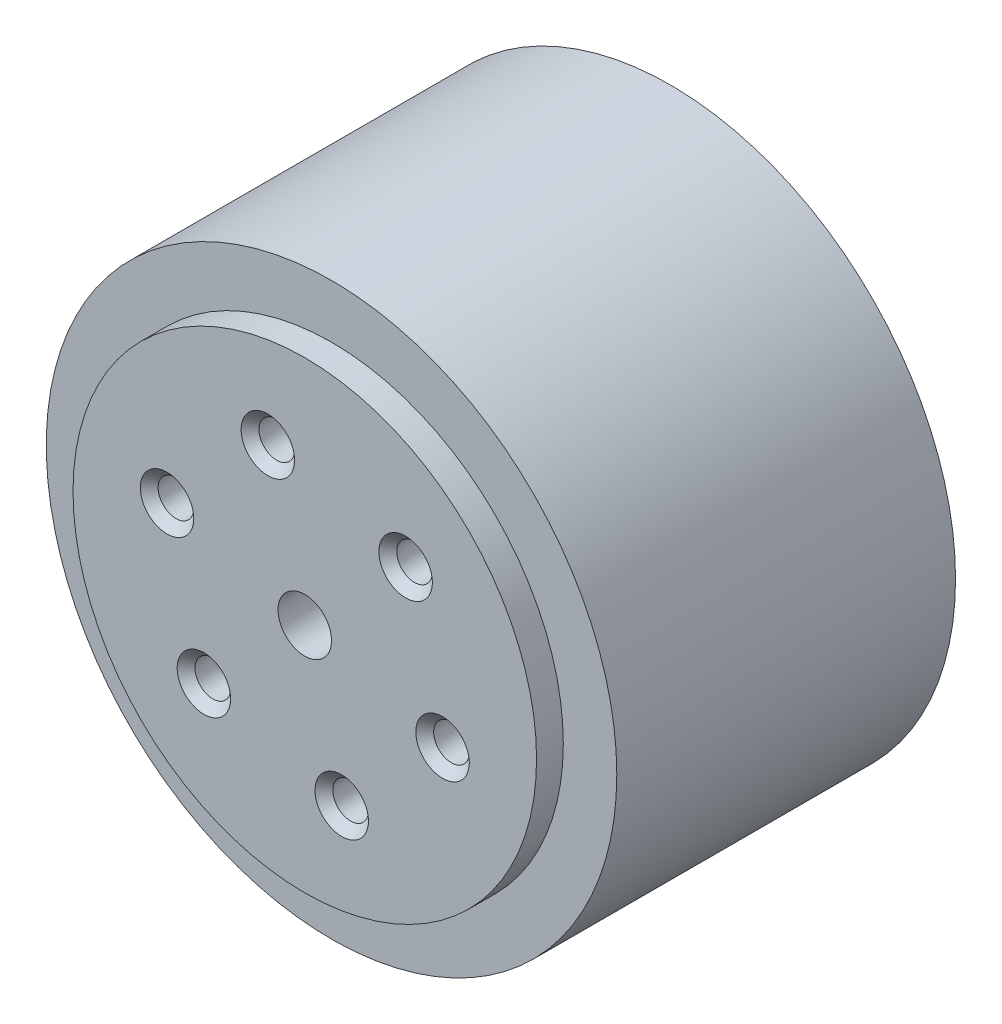
from build123d import *

# Parameters (mm, degrees)
CROQUIS1_W                    = 16
CROQUIS1_H                    = 19
CROQUIS2_R                    = 13
SALIENTE_EXTRUIR1_DEPTH       = 1.5
SALIENTE_EXTRUIR2_START       = 1.5
CROQUIS3_R                    = 13
SALIENTE_EXTRUIR2_DEPTH       = 1.5
TALADRO1_D                    = 3
TALADRO1_CBORE_D              = 18
TALADRO1_CBORE_DEPTH          = 15
DI_METRO_DE_TALADRO_2_0_2_1_D = 2
CORTAR_EXTRUIR1_DEPTH         = 10
CORTAR_EXTRUIR1_DEPTH_BACK    = 6
CROQUIS10_R                   = 1.25
CHAFL_N1_SIZE                 = 0.5


with BuildPart() as part:
    # Croquis1 → Revolución1 (revolve)
    with BuildSketch(Plane(origin=(0, 0, 0), x_dir=(1, 0, 0), z_dir=(0, 1, 0))):
        with Locations((8, 0.635135135)):
            Rectangle(CROQUIS1_W, CROQUIS1_H)
    revolve(axis=Axis((0, 0, -10.135135135), (0, 0, 1)))

    # Croquis2 → Saliente-Extruir1 (add)
    with BuildSketch(Plane.XY.offset(8.864864865)):
        Circle(CROQUIS2_R)
    extrude(amount=SALIENTE_EXTRUIR1_DEPTH)

    # Croquis3 → Saliente-Extruir2 (add)
    with BuildSketch(Plane(origin=(0, 0, -10.135135135), x_dir=(-1, 0, 0), z_dir=(0, 0, -1)).offset(SALIENTE_EXTRUIR2_START)):
        with Locations(Location((0, 0, 0), (0, 0, 180))):
            Circle(CROQUIS3_R)
    extrude(amount=-SALIENTE_EXTRUIR2_DEPTH)

    # Taladro1 (through all)
    with Locations(Plane(origin=(0, 0, -11.635135135), x_dir=(-1, 0, 0), z_dir=(0, 0, -1))):
        with Locations((0, 0)):
            CounterBoreHole(TALADRO1_D / 2, TALADRO1_CBORE_D / 2, TALADRO1_CBORE_DEPTH)

    # Diámetro de taladro Ø2.0 (2)1 (through all)
    with Locations(Plane.XY.offset(10.364864865)):
        with Locations((5.656854249, 5.656854249), (7.72740661, -2.070552361), (2.070552361, -7.72740661), (-5.656854249, -5.656854249), (-7.72740661, 2.070552361), (-2.070552361, 7.72740661)):
            Hole(DI_METRO_DE_TALADRO_2_0_2_1_D / 2)

    # Croquis10 → Cortar-Extruir1 (cut, two sides: drawn at the far end of the back side and taken through both)
    with BuildSketch(Plane(origin=(0, 0, 0), x_dir=(0, 0, -1), z_dir=(1, 0, 0)).offset(-CORTAR_EXTRUIR1_DEPTH_BACK)):
        with Locations(Location((-6.864864865, 0, 0), (0, 0, 180))):
            Circle(CROQUIS10_R)
    extrude(amount=CORTAR_EXTRUIR1_DEPTH + CORTAR_EXTRUIR1_DEPTH_BACK, mode=Mode.SUBTRACT)

    # Chaflán1
    chafl_n1_edges = [part.edges().sort_by_distance(p)[0] for p in [
        (9, 0, -11.635135135),
        (-1.070552361, 7.72740661, 10.364864865),
        (-6.72740661, 2.070552361, 10.364864865),
        (-4.656854249, -5.656854249, 10.364864865),
        (3.070552361, -7.72740661, 10.364864865),
        (8.72740661, -2.070552361, 10.364864865),
        (6.656854249, 5.656854249, 10.364864865),
    ]]
    chamfer(chafl_n1_edges, length=CHAFL_N1_SIZE)


solid = part.part
